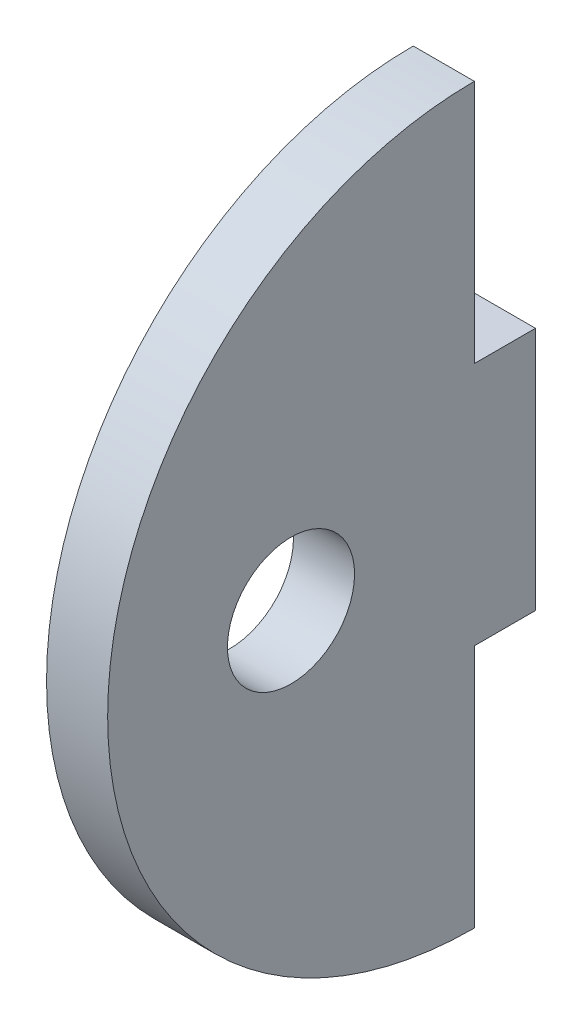
from build123d import *

# Parameters (mm, degrees)
SKETCH_1_R          = 5.2
EXTRUDE_1_DEPTH     = 5
SKETCH_2_W          = 5
SKETCH_2_H          = 10
CUT_EXTRUDE_1_DEPTH = 62.23724357


with BuildPart() as part:
    # Эскиз1 → Бобышка-Вытянуть1 (new body)
    with BuildSketch(Plane(origin=(0, 0, 0), x_dir=(0, 0, -1), z_dir=(1, 0, 0))):
        with BuildLine():
            Line((0, 0), (-5, 0))
            Line((-5, 0), (-5, -10))
            ThreePointArc((-5, -10), (-35, 20), (-5, 50))
            Line((-5, 50), (-5, 40))
            Line((-5, 40), (0, 40))
            Line((0, 40), (0, 0))
        make_face()
        with Locations((-20, 20)):
            Circle(SKETCH_1_R, mode=Mode.SUBTRACT)
    extrude(amount=EXTRUDE_1_DEPTH)

    # Эскиз2 → Вырез-Вытянуть1 (cut, through all)
    with BuildSketch(Plane(origin=(5, 0, 0), x_dir=(0, 0, -1), z_dir=(1, 0, 0))):
        with Locations((-2.5, 35)):
            Rectangle(SKETCH_2_W, SKETCH_2_H)
        with Locations((-2.5, 5)):
            Rectangle(SKETCH_2_W, SKETCH_2_H)
    extrude(amount=-CUT_EXTRUDE_1_DEPTH, mode=Mode.SUBTRACT)


solid = part.part
